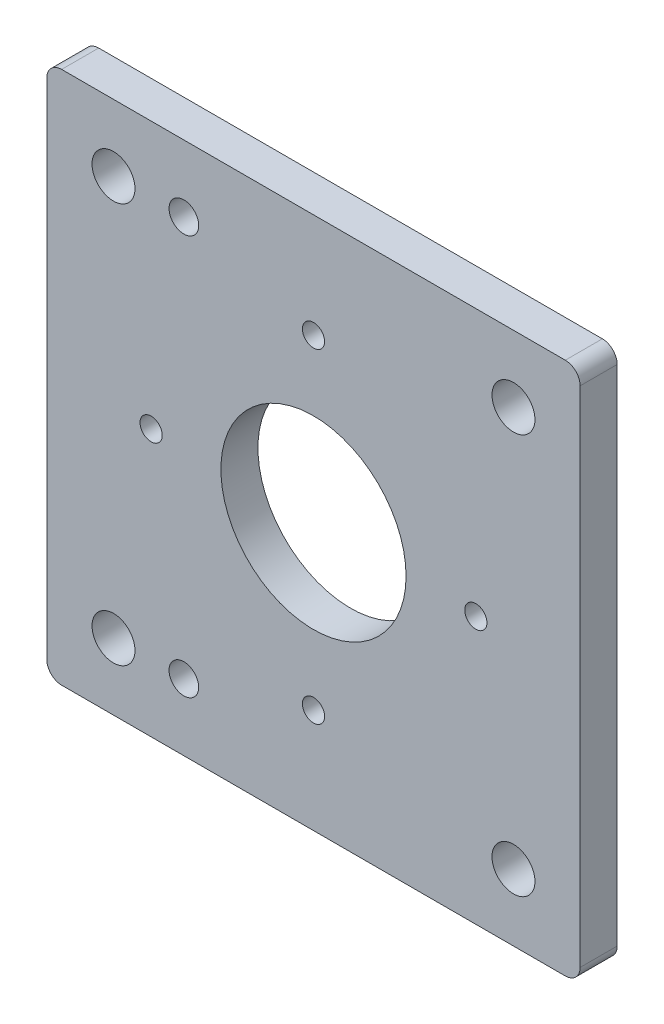
from build123d import *

# Parameters (mm, degrees)
SKETCH1_W           = 72
SKETCH1_H           = 72
SKETCH1_R           = 2.9
SKETCH1_R_2         = 12.5
SKETCH1_R_3         = 1.5
SKETCH1_R_4         = 2
BOSS_EXTRUDE1_DEPTH = 5
FILLET1_R           = 2


with BuildPart() as part:
    # Sketch1 → Boss-Extrude1 (new body)
    with BuildSketch(Plane.XY):
        Rectangle(SKETCH1_W, SKETCH1_H)
        with Locations((-27, 27)):
            Circle(SKETCH1_R, mode=Mode.SUBTRACT)
        with Locations((27, 27)):
            Circle(SKETCH1_R, mode=Mode.SUBTRACT)
        with Locations((27, -27)):
            Circle(SKETCH1_R, mode=Mode.SUBTRACT)
        with Locations((-27, -27)):
            Circle(SKETCH1_R, mode=Mode.SUBTRACT)
        Circle(SKETCH1_R_2, mode=Mode.SUBTRACT)
        with Locations((0, 21.92)):
            Circle(SKETCH1_R_3, mode=Mode.SUBTRACT)
        with Locations((0, -21.92)):
            Circle(SKETCH1_R_3, mode=Mode.SUBTRACT)
        with Locations((-21.92, 0)):
            Circle(SKETCH1_R_3, mode=Mode.SUBTRACT)
        with Locations((21.92, 0)):
            Circle(SKETCH1_R_3, mode=Mode.SUBTRACT)
        with Locations((-17.5, 27)):
            Circle(SKETCH1_R_4, mode=Mode.SUBTRACT)
        with Locations((-17.5, -27)):
            Circle(SKETCH1_R_4, mode=Mode.SUBTRACT)
    extrude(amount=BOSS_EXTRUDE1_DEPTH)

    # Fillet1
    fillet1_edges = [part.edges().sort_by_distance(p)[0] for p in [
        (-36, 36, 2.5),
        (36, 36, 2.5),
        (36, -36, 2.5),
        (-36, -36, 2.5),
    ]]
    fillet(fillet1_edges, radius=FILLET1_R)


solid = part.part
